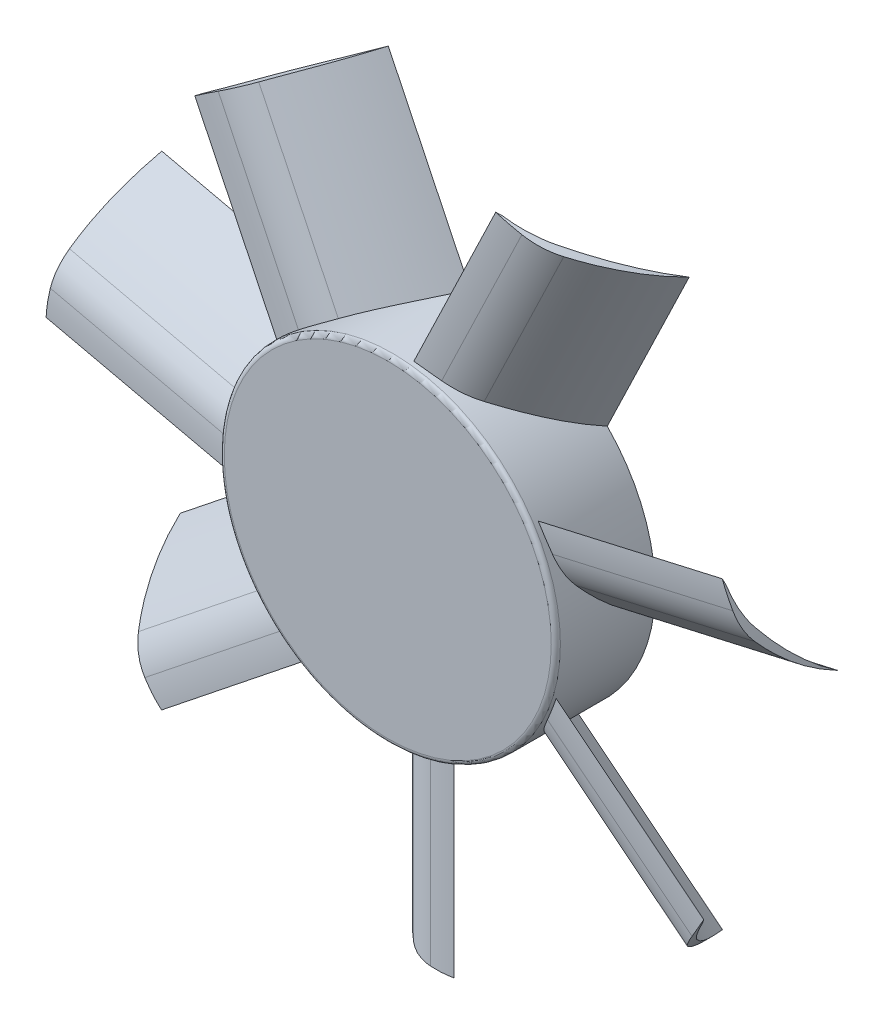
from build123d import *

# Parameters (mm, degrees)
SKETCH_1_R               = 11
EXTRUDE_1_DEPTH          = 6.5
SKETCH_2_R               = 9.75
CUT_EXTRUDE_1_DEPTH      = 5.5
SKETCH_3_R               = 0.7
EXTRUDE_2_DEPTH          = 7.5
CHAMFER_1_SIZE           = 0.6
EXTRUDE_START            = -10
EXTRUDE_3_DEPTH          = 23
PATTERN_CIRCULAR_1_COUNT = 7
FILLET_1_R               = 0.3
SKETCH_5_OUTSIDE_W       = 86.532
SKETCH_5_OUTSIDE_H       = 84.877
SKETCH_5_OUTSIDE_R       = 23
CUT_EXTRUDE_2_DEPTH      = 23


with BuildPart() as part:
    # Эскиз1 → Бобышка-Вытянуть1 (new body)
    with BuildSketch(Plane.XY):
        with Locations(Location((0, 0, 0), (0, 0, 180))):
            Circle(SKETCH_1_R)
    extrude(amount=EXTRUDE_1_DEPTH)

    # Эскиз2 → Вырез-Вытянуть1 (cut)
    with BuildSketch(Plane(origin=(0, 0, 0), x_dir=(-1, 0, 0), z_dir=(0, 0, -1))):
        Circle(SKETCH_2_R)
    extrude(amount=-CUT_EXTRUDE_1_DEPTH, mode=Mode.SUBTRACT)

    # Эскиз3 → Бобышка-Вытянуть2 (add)
    with BuildSketch(Plane(origin=(0, 0, 5.5), x_dir=(-1, 0, 0), z_dir=(0, 0, -1))):
        Circle(SKETCH_3_R)
    extrude(amount=EXTRUDE_2_DEPTH)

    # Фаска1
    chamfer_1_edges = [part.edges().sort_by_distance(p)[0] for p in [
        (0.7, 0, -2),
    ]]
    chamfer(chamfer_1_edges, length=CHAMFER_1_SIZE)

    # Эскиз4 → Бобышка-Вытянуть3 (add)
    with BuildSketch(Plane(origin=(0, 0, 0), x_dir=(1, 0, 0), z_dir=(0, 1, 0)).offset(EXTRUDE_START)):
        with BuildLine():
            ThreePointArc((3.75, -5.9), (2.910954768, -5.877455841), (2.076425924, -5.787640746))
            ThreePointArc((2.076425924, -5.787640746), (1.016898237, -5.476222818), (0.082906283, -4.886952865))
            ThreePointArc((0.082906283, -4.886952865), (-2.084101368, -2.63998988), (-3.75, 0))
            ThreePointArc((-3.75, 0), (-1.712075741, -2.552424329), (0.739315837, -4.710822941))
            ThreePointArc((0.739315837, -4.710822941), (2.002660979, -5.416468702), (3.40130611, -5.787640746))
            ThreePointArc((3.40130611, -5.787640746), (3.575082247, -5.845591808), (3.75, -5.9))
        make_face()
    extrude_3 = extrude(amount=-EXTRUDE_3_DEPTH)

    # Круговой массив1: Бобышка-Вытянуть3 ×7 about axis
    pattern_circular_1_axis = Axis((0, 0, 0), (0, 0, 1))
    for i in range(1, PATTERN_CIRCULAR_1_COUNT):
        add(extrude_3.rotate(pattern_circular_1_axis, i * 360 / PATTERN_CIRCULAR_1_COUNT))

    # Скругление1
    fillet_1_edges = [part.edges().sort_by_distance(p)[0] for p in [
        (11, 0, 6.5),
    ]]
    fillet(fillet_1_edges, radius=FILLET_1_R)

    # Эскиз5 outside → Вырез-Вытянуть2 (cut)
    with BuildSketch(Plane.XY.offset(6.5)):
        with Locations((0, -0.8205)):
            Rectangle(SKETCH_5_OUTSIDE_W, SKETCH_5_OUTSIDE_H)
        Circle(SKETCH_5_OUTSIDE_R, mode=Mode.SUBTRACT)
    extrude(amount=-CUT_EXTRUDE_2_DEPTH, mode=Mode.SUBTRACT)


solid = part.part
